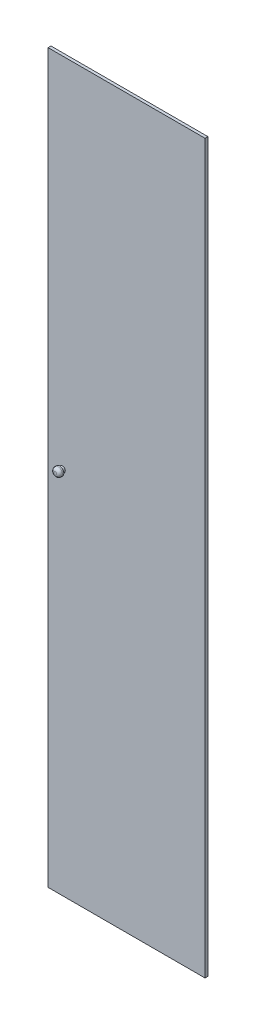
from build123d import *

# Parameters (mm, degrees)
SKETCH1_W           = 550
SKETCH1_H           = 2550
BOSS_EXTRUDE1_DEPTH = 10
SKETCH2_R           = 10
BOSS_EXTRUDE2_DEPTH = 10
SKETCH3_R           = 15
BOSS_EXTRUDE3_DEPTH = 15
FILLET1_R           = 10


with BuildPart() as part:
    # Sketch1 → Boss-Extrude1 (new body)
    with BuildSketch(Plane.XY):
        Rectangle(SKETCH1_W, SKETCH1_H)
    extrude(amount=BOSS_EXTRUDE1_DEPTH)

    # Sketch2 → Boss-Extrude2 (add)
    with BuildSketch(Plane.XY.offset(10)):
        with Locations((-225, 20)):
            Circle(SKETCH2_R)
    extrude(amount=BOSS_EXTRUDE2_DEPTH)

    # Sketch3 → Boss-Extrude3 (add)
    with BuildSketch(Plane.XY.offset(20)):
        with Locations((-225, 20)):
            Circle(SKETCH3_R)
    extrude(amount=BOSS_EXTRUDE3_DEPTH)

    # Fillet1
    fillet1_edges = [part.edges().sort_by_distance(p)[0] for p in [
        (-240, 20, 35),
    ]]
    fillet(fillet1_edges, radius=FILLET1_R)


solid = part.part
